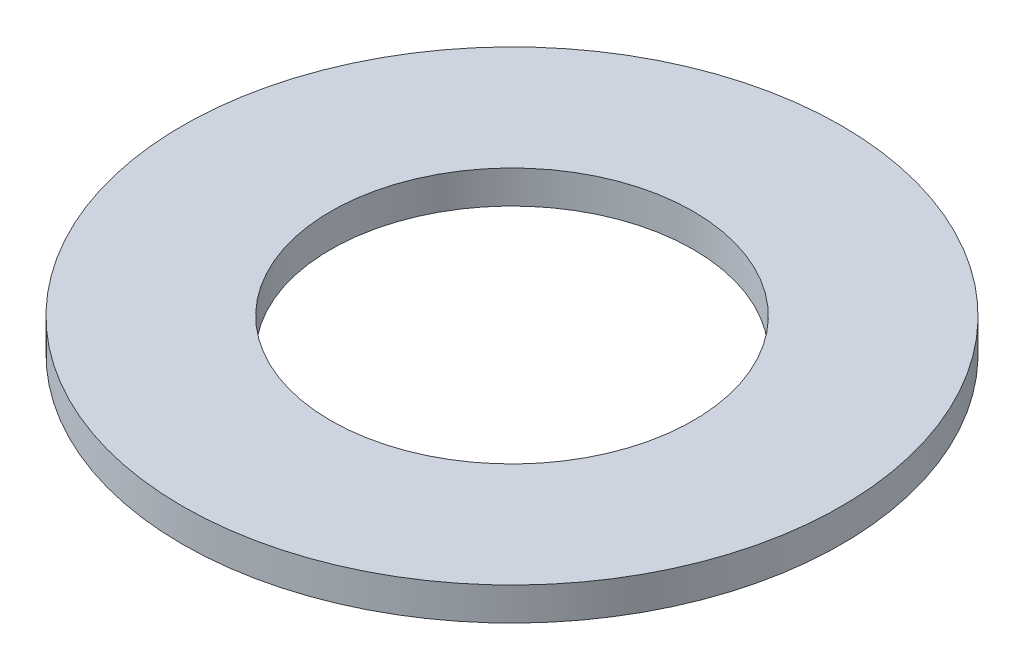
from build123d import *

# Parameters (mm, degrees)
SKIZZE1_R                       = 20
SKIZZE1_R_2                     = 11
AUFSATZ_LINEAR_AUSTRAGEN1_DEPTH = 2


with BuildPart() as part:
    # Skizze1 → Aufsatz-Linear austragen1 (new body)
    with BuildSketch(Plane(origin=(0, 0, 0), x_dir=(1, 0, 0), z_dir=(0, 1, 0))):
        with Locations(Location((0, 0, 0), (0, 0, 270))):
            Circle(SKIZZE1_R)
        with Locations(Location((0, 0, 0), (0, 0, 270))):
            Circle(SKIZZE1_R_2, mode=Mode.SUBTRACT)
    extrude(amount=AUFSATZ_LINEAR_AUSTRAGEN1_DEPTH)


solid = part.part
